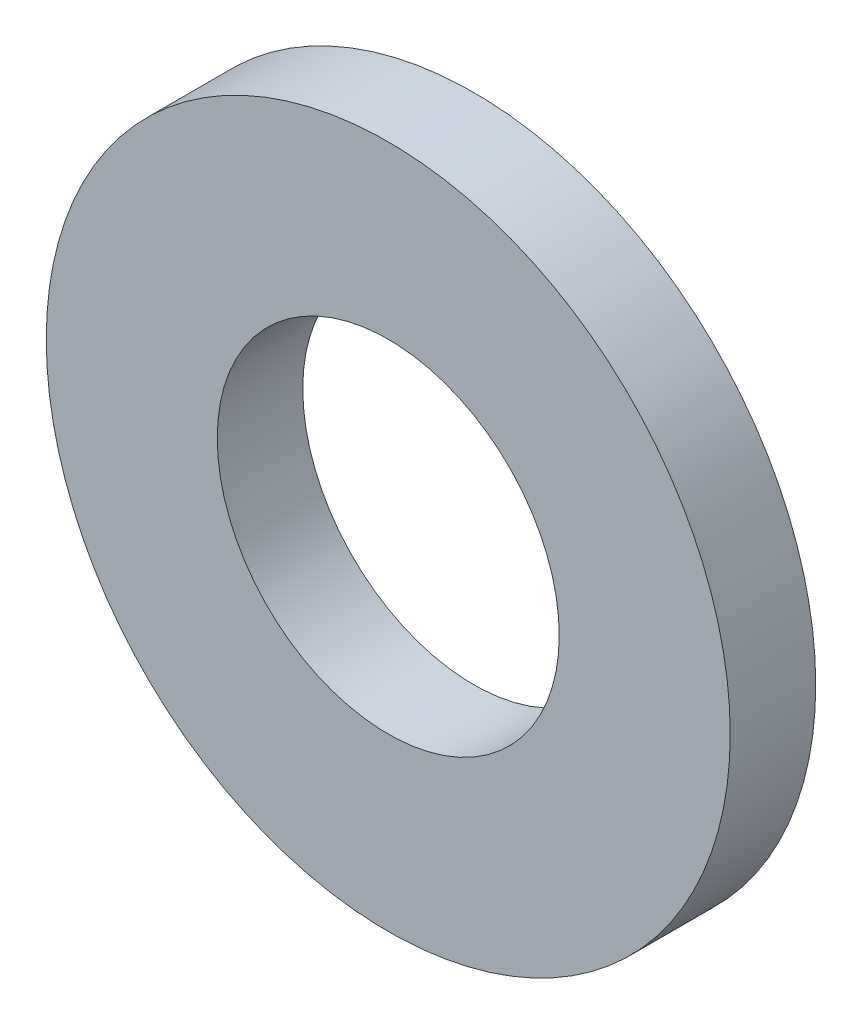
from build123d import *

# Parameters (mm, degrees)
SKETCH_1_R      = 6
SKETCH_1_R_2    = 3
EXTRUDE_1_DEPTH = 1.5


with BuildPart() as part:
    # 草图1 → 凸台-拉伸1 (new body)
    with BuildSketch(Plane.XY):
        Circle(SKETCH_1_R)
        Circle(SKETCH_1_R_2, mode=Mode.SUBTRACT)
    extrude(amount=EXTRUDE_1_DEPTH)


solid = part.part
